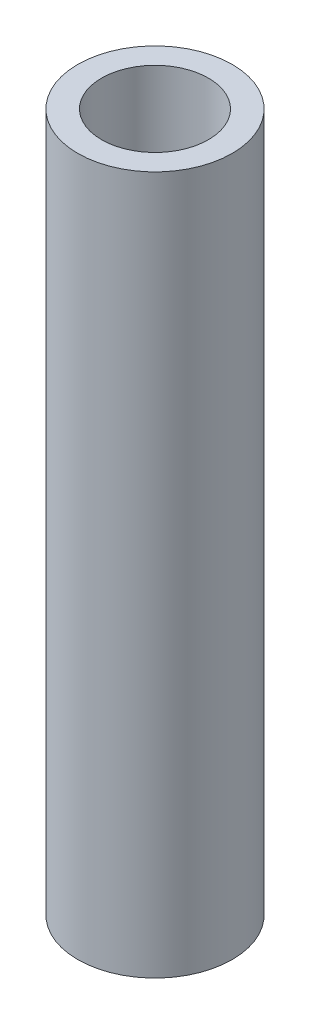
from build123d import *

# Parameters (mm, degrees)
SKETCH1_R           = 4.127000001
SKETCH1_R_2         = 2.857000001
BOSS_EXTRUDE1_DEPTH = 37.338


with BuildPart() as part:
    # Sketch1 → Boss-Extrude1 (new body)
    with BuildSketch(Plane(origin=(0, 0, 0), x_dir=(1, 0, 0), z_dir=(0, 1, 0))):
        with Locations(Location((0, 0, 0), (0, 0, 270))):
            Circle(SKETCH1_R)
        with Locations(Location((0, 0, 0), (0, 0, 270))):
            Circle(SKETCH1_R_2, mode=Mode.SUBTRACT)
    extrude(amount=BOSS_EXTRUDE1_DEPTH)


solid = part.part
